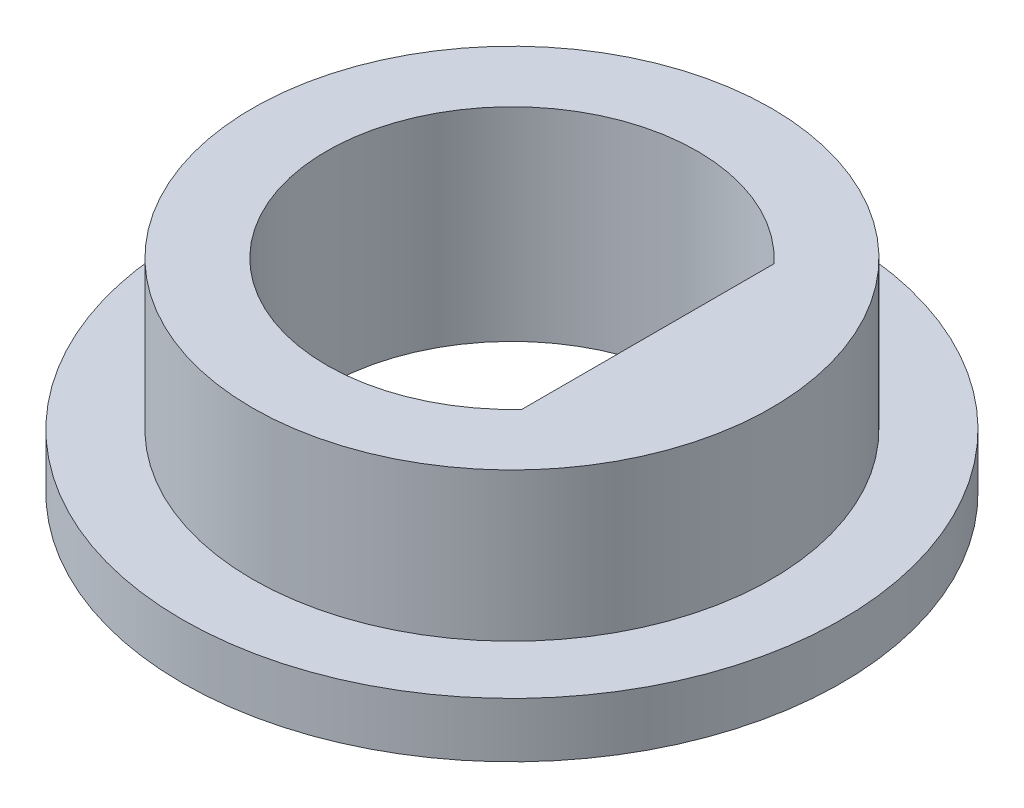
from build123d import *

# Parameters (mm, degrees)
SKETCH1_R           = 6
BOSS_EXTRUDE1_DEPTH = 1
SKETCH2_R           = 4.725
BOSS_EXTRUDE2_DEPTH = 2.7
CUT_EXTRUDE1_DEPTH  = 10.256889326


with BuildPart() as part:
    # Sketch1 → Boss-Extrude1 (new body)
    with BuildSketch(Plane(origin=(0, 0, 0), x_dir=(1, 0, 0), z_dir=(0, 1, 0))):
        with Locations(Location((0, 0, 0), (0, 0, 270))):
            Circle(SKETCH1_R)
    extrude(amount=BOSS_EXTRUDE1_DEPTH)

    # Sketch2 → Boss-Extrude2 (add)
    with BuildSketch(Plane(origin=(0, 1, 0), x_dir=(1, 0, 0), z_dir=(0, 1, 0))):
        with Locations(Location((0, 0, 0), (0, 0, 90))):
            Circle(SKETCH2_R)
    extrude(amount=BOSS_EXTRUDE2_DEPTH)

    # Sketch3 → Cut-Extrude1 (cut, through all)
    with BuildSketch(Plane(origin=(0, 3.7, 0), x_dir=(1, 0, 0), z_dir=(0, 1, 0))):
        with BuildLine():
            Line((2.475, 2.294558781), (2.475, -2.294558781))
            ThreePointArc((2.475, -2.294558781), (-3.375, 0), (2.475, 2.294558781))
        make_face()
    extrude(amount=-CUT_EXTRUDE1_DEPTH, mode=Mode.SUBTRACT)


solid = part.part
